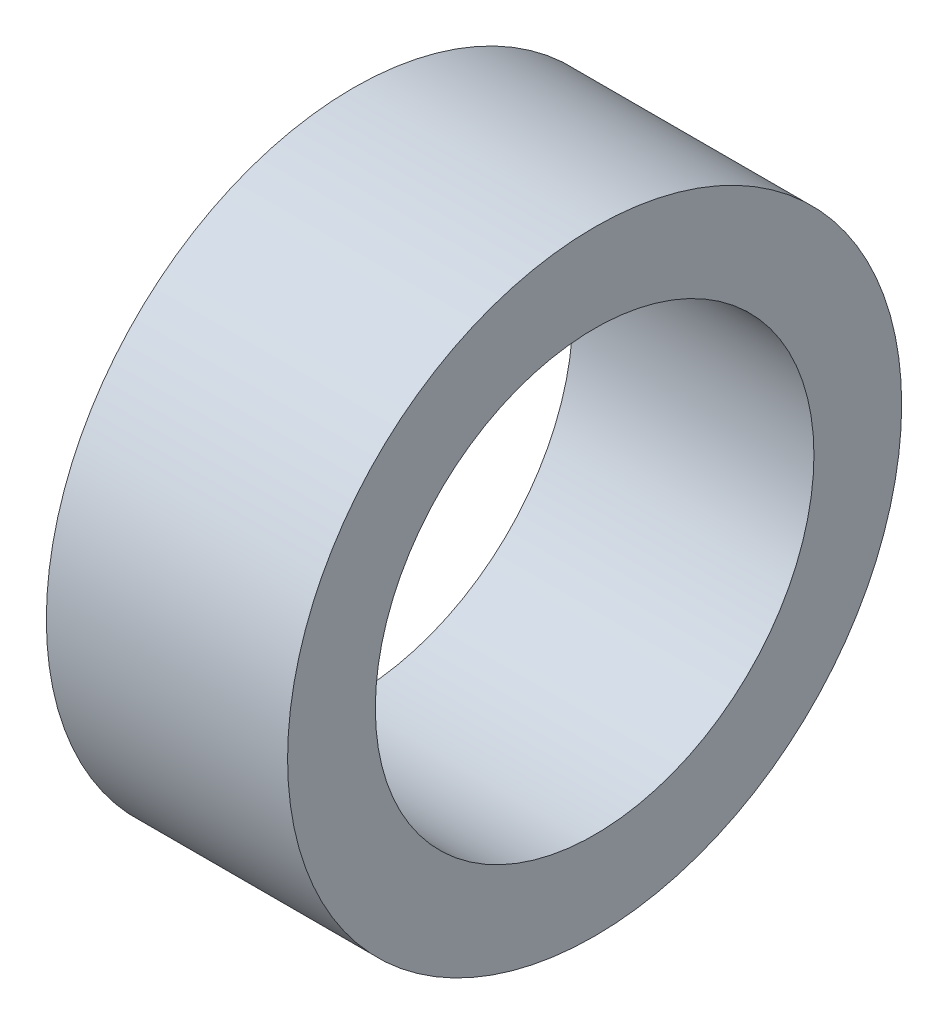
from build123d import *

# Parameters (mm, degrees)
SKETCH1_W = 5.5
SKETCH1_H = 2


with BuildPart() as part:
    # Sketch1 → Revolve1 (revolve)
    with BuildSketch(Plane.XY, mode=Mode.PRIVATE) as revolve1_sk:
        with Locations((23.75, 6)):
            Rectangle(SKETCH1_W, SKETCH1_H)
    revolve(revolve1_sk.sketch.rotate(Axis((21, 0, 0), (1, 0, 0)), 270), axis=Axis((21, 0, 0), (1, 0, 0)))


solid = part.part
